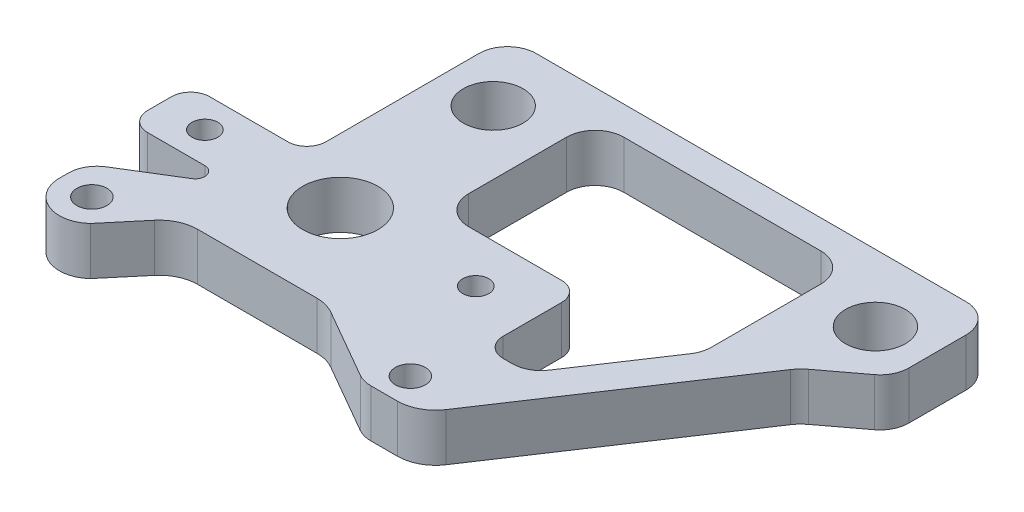
from build123d import *

# Parameters (mm, degrees)
SKETCH4_R           = 2
SKETCH4_R_2         = 1.7272
SKETCH4_R_3         = 5
SKETCH4_R_4         = 3.96875
BOSS_EXTRUDE2_DEPTH = 6.35
FILLET1_R           = 5.08
FILLET7_R           = 3.81
FILLET9_R           = 5.08
FILLET10_R          = 1.27
FILLET11_R          = 3.81
FILLET12_R          = 2.54
FILLET13_R          = 3.81


with BuildPart() as part:
    # Sketch4 → Boss-Extrude2 (new body)
    # profile 1 of 2: a face of its own
    with BuildSketch(Plane(origin=(0, 0, 0), x_dir=(1, 0, 0), z_dir=(0, 1, 0))):
        with BuildLine():
            Line((22.483900583, -18.4375), (28.735494078, -18.4375))
            Line((28.735494078, -18.4375), (48.985566477, 12.027918285))
            Line((48.985566477, 12.027918285), (54.680415238, 16.319294633))
            ThreePointArc((54.680415238, 16.319294633), (55.797199918, 17.662082259), (56.1975, 19.362095927))
            Line((56.1975, 19.362095927), (56.1975, 26.9875))
            ThreePointArc((56.1975, 26.9875), (55.081576836, 29.681576836), (52.3875, 30.7975))
            Line((52.3875, 30.7975), (-4.7625, 30.7975))
            ThreePointArc((-4.7625, 30.7975), (-7.456576836, 29.681576836), (-8.5725, 26.9875))
            Line((-8.5725, 26.9875), (-8.5725, 12.607500122))
            Line((-8.5725, 12.607500122), (-8.5725, 4.1275))
            Line((-8.5725, 4.1275), (-24.03032317, 4.1275))
            Line((-24.03032317, 4.1275), (-24.03032317, -4.1275))
            Line((-24.03032317, -4.1275), (-9.399713355, -4.1275))
            Line((-9.399713355, -4.1275), (-22.098, -11.933490986))
            Line((-22.098, -11.933490986), (-22.098, -15.24))
            ThreePointArc((-22.098, -15.24), (-19.494143335, -19.203185162), (-14.822948297, -18.386580561))
            Line((-14.822948297, -18.386580561), (-9.399713355, -11.933490986))
            Line((-9.399713355, -11.933490986), (10.16293305, -11.933490986))
            Line((10.16293305, -11.933490986), (20.583679925, -17.929811531))
            ThreePointArc((20.583679925, -17.929811531), (21.500464498, -18.308390309), (22.483900583, -18.4375))
        make_face()
        with Locations(Location((-17.78, -15.24, 0), (0, 0, 270))):
            Circle(SKETCH4_R, mode=Mode.SUBTRACT)
        with Locations(Location((-18.000000004, 0, 0), (0, 0, 270))):
            Circle(SKETCH4_R_2, mode=Mode.SUBTRACT)
        with Locations(Location((0, 0, 0), (0, 0, 270))):
            Circle(SKETCH4_R_3, mode=Mode.SUBTRACT)
        with Locations(Location((24.012521227, -14.703599027, 0), (0, 0, 270))):
            Circle(SKETCH4_R, mode=Mode.SUBTRACT)
        with Locations(Location((18.000000004, 0, 0), (0, 0, 270))):
            Circle(SKETCH4_R_2, mode=Mode.SUBTRACT)
        with Locations(Location((-1.5875, 21.9075, 0), (0, 0, 270))):
            Circle(SKETCH4_R_4, mode=Mode.SUBTRACT)
        Polygon((6.882386285, 6.3725), (6.882386285, 26.9875), (40.692955064, 26.9875), (40.692955064, 7.472580753), (31.404651622, -6.501297657), (25.585775375, -6.501297657), (25.585775375, 6.3725), align=None, mode=Mode.SUBTRACT)
        with Locations(Location((49.2125, 21.9075, 0), (0, 0, 270))):
            Circle(SKETCH4_R_4, mode=Mode.SUBTRACT)
    # profile 2 of 2: a face of its own
    with BuildSketch(Plane(origin=(0, 0, 0), x_dir=(1, 0, 0), z_dir=(0, 1, 0))):
        with BuildLine():
            Line((22.483900583, -18.4375), (28.735494078, -18.4375))
            Line((28.735494078, -18.4375), (48.985566477, 12.027918285))
            Line((48.985566477, 12.027918285), (54.680415238, 16.319294633))
            ThreePointArc((54.680415238, 16.319294633), (55.797199918, 17.662082259), (56.1975, 19.362095927))
            Line((56.1975, 19.362095927), (56.1975, 26.9875))
            ThreePointArc((56.1975, 26.9875), (55.081576836, 29.681576836), (52.3875, 30.7975))
            Line((52.3875, 30.7975), (-4.7625, 30.7975))
            ThreePointArc((-4.7625, 30.7975), (-7.456576836, 29.681576836), (-8.5725, 26.9875))
            Line((-8.5725, 26.9875), (-8.5725, 12.607500122))
            Line((-8.5725, 12.607500122), (-8.5725, 4.1275))
            Line((-8.5725, 4.1275), (-24.03032317, 4.1275))
            Line((-24.03032317, 4.1275), (-24.03032317, -4.1275))
            Line((-24.03032317, -4.1275), (-9.399713355, -4.1275))
            Line((-9.399713355, -4.1275), (-22.098, -11.933490986))
            Line((-22.098, -11.933490986), (-22.098, -15.24))
            ThreePointArc((-22.098, -15.24), (-19.494143335, -19.203185162), (-14.822948297, -18.386580561))
            Line((-14.822948297, -18.386580561), (-9.399713355, -11.933490986))
            Line((-9.399713355, -11.933490986), (10.16293305, -11.933490986))
            Line((10.16293305, -11.933490986), (20.583679925, -17.929811531))
            ThreePointArc((20.583679925, -17.929811531), (21.500464498, -18.308390309), (22.483900583, -18.4375))
        make_face()
        with Locations(Location((-17.78, -15.24, 0), (0, 0, 270))):
            Circle(SKETCH4_R, mode=Mode.SUBTRACT)
        with Locations(Location((-18.000000004, 0, 0), (0, 0, 270))):
            Circle(SKETCH4_R_2, mode=Mode.SUBTRACT)
        with Locations(Location((0, 0, 0), (0, 0, 270))):
            Circle(SKETCH4_R_3, mode=Mode.SUBTRACT)
        with Locations(Location((24.012521227, -14.703599027, 0), (0, 0, 270))):
            Circle(SKETCH4_R, mode=Mode.SUBTRACT)
        with Locations(Location((18.000000004, 0, 0), (0, 0, 270))):
            Circle(SKETCH4_R_2, mode=Mode.SUBTRACT)
        with Locations(Location((-1.5875, 21.9075, 0), (0, 0, 270))):
            Circle(SKETCH4_R_4, mode=Mode.SUBTRACT)
        Polygon((6.882386285, 6.3725), (6.882386285, 26.9875), (40.692955064, 26.9875), (40.692955064, 7.472580753), (31.404651622, -6.501297657), (25.585775375, -6.501297657), (25.585775375, 6.3725), align=None, mode=Mode.SUBTRACT)
        with Locations(Location((49.2125, 21.9075, 0), (0, 0, 270))):
            Circle(SKETCH4_R_4, mode=Mode.SUBTRACT)
    extrude(amount=-BOSS_EXTRUDE2_DEPTH)

    # Fillet1
    fillet1_edges = [part.edges().sort_by_distance(p)[0] for p in [
        (48.985566477, -3.175, -12.027918285),
        (28.735494078, -3.175, 18.4375),
    ]]
    fillet(fillet1_edges, radius=FILLET1_R)

    # Fillet7
    fillet7_edges = [part.edges().sort_by_distance(p)[0] for p in [
        (40.692955064, -3.175, -7.472580753),
        (40.692955064, -3.175, -26.9875),
        (6.882386285, -3.175, -26.9875),
        (6.882386285, -3.175, -6.3725),
    ]]
    fillet(fillet7_edges, radius=FILLET7_R)

    # Fillet9
    fillet9_edges = [part.edges().sort_by_distance(p)[0] for p in [
        (10.16293305, -3.175, 11.933490986),
        (-9.399713355, -3.175, 11.933490986),
    ]]
    fillet(fillet9_edges, radius=FILLET9_R)

    # Fillet10
    fillet10_edges = [part.edges().sort_by_distance(p)[0] for p in [
        (-9.399713355, -3.175, 4.1275),
    ]]
    fillet(fillet10_edges, radius=FILLET10_R)

    # Fillet11
    fillet11_edges = [part.edges().sort_by_distance(p)[0] for p in [
        (-22.098, -3.175, 11.933490986),
    ]]
    fillet(fillet11_edges, radius=FILLET11_R)

    # Fillet12
    fillet12_edges = [part.edges().sort_by_distance(p)[0] for p in [
        (25.585775375, -3.175, -6.3725),
        (25.585775375, -3.175, 6.501297657),
        (-24.03032317, -3.175, 4.1275),
        (-24.03032317, -3.175, -4.1275),
        (-8.5725, -3.175, -4.1275),
    ]]
    fillet(fillet12_edges, radius=FILLET12_R)

    # Fillet13
    fillet13_edges = [part.edges().sort_by_distance(p)[0] for p in [
        (31.404651622, -3.175, 6.501297657),
    ]]
    fillet(fillet13_edges, radius=FILLET13_R)


solid = part.part
